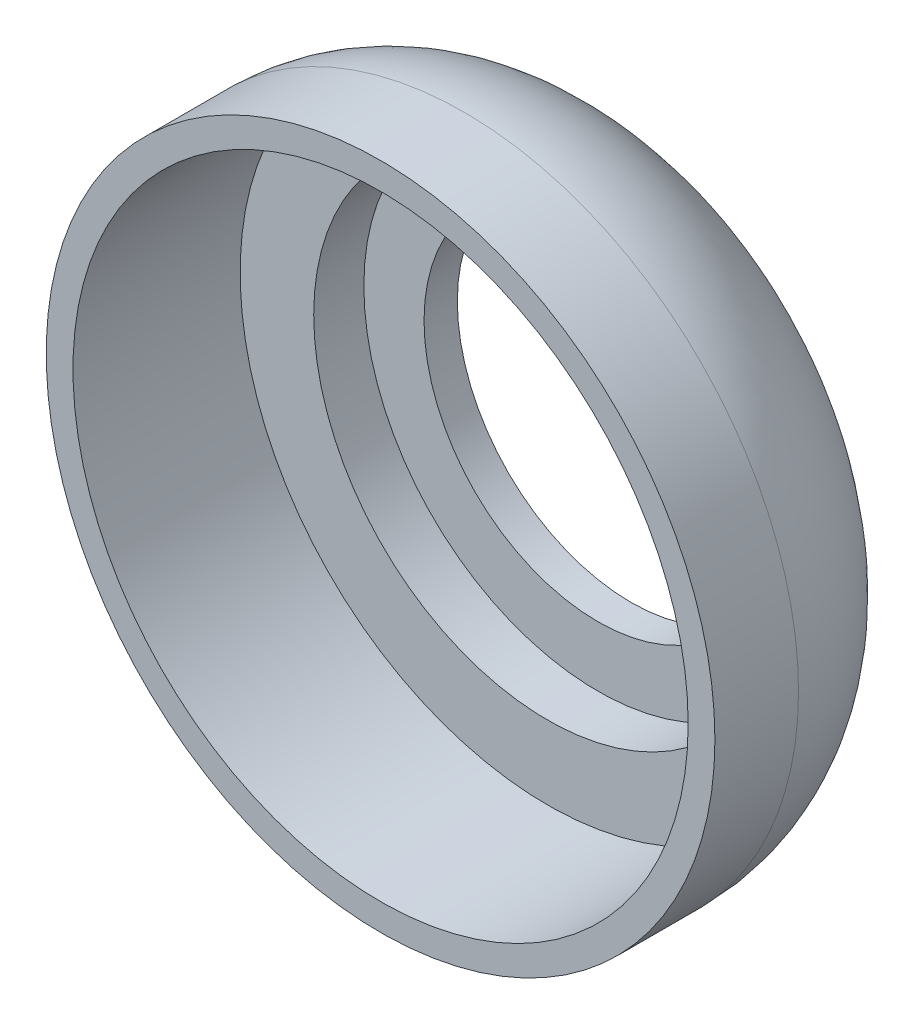
from build123d import *

# Parameters (mm, degrees)
SKETCH1_R           = 20
BOSS_EXTRUDE1_DEPTH = 15
FILLET1_R           = 10
SKETCH2_R           = 14
CUT_EXTRUDE1_DEPTH  = 13
SKETCH4_R           = 10.4
CUT_EXTRUDE3_DEPTH  = 11
SKETCH3_R           = 18.4
CUT_EXTRUDE4_DEPTH  = 10


with BuildPart() as part:
    # Sketch1 → Boss-Extrude1 (new body)
    with BuildSketch(Plane.XY):
        Circle(SKETCH1_R)
    extrude(amount=BOSS_EXTRUDE1_DEPTH)

    # Fillet1
    fillet1_edges = [part.edges().sort_by_distance(p)[0] for p in [
        (-20, 0, 0),
    ]]
    fillet(fillet1_edges, radius=FILLET1_R)

    # Sketch2 → Cut-Extrude1 (cut)
    with BuildSketch(Plane.XY.offset(15)):
        Circle(SKETCH2_R)
    extrude(amount=-CUT_EXTRUDE1_DEPTH, mode=Mode.SUBTRACT)

    # Sketch4 → Cut-Extrude3 (cut)
    with BuildSketch(Plane(origin=(0, 0, 0), x_dir=(-1, 0, 0), z_dir=(0, 0, -1))):
        with Locations(Location((0, 0, 0), (0, 0, 180))):
            Circle(SKETCH4_R)
    extrude(amount=-CUT_EXTRUDE3_DEPTH, mode=Mode.SUBTRACT)

    # Sketch3 → Cut-Extrude4 (cut)
    with BuildSketch(Plane.XY.offset(15)):
        Circle(SKETCH3_R)
    extrude(amount=-CUT_EXTRUDE4_DEPTH, mode=Mode.SUBTRACT)


solid = part.part
